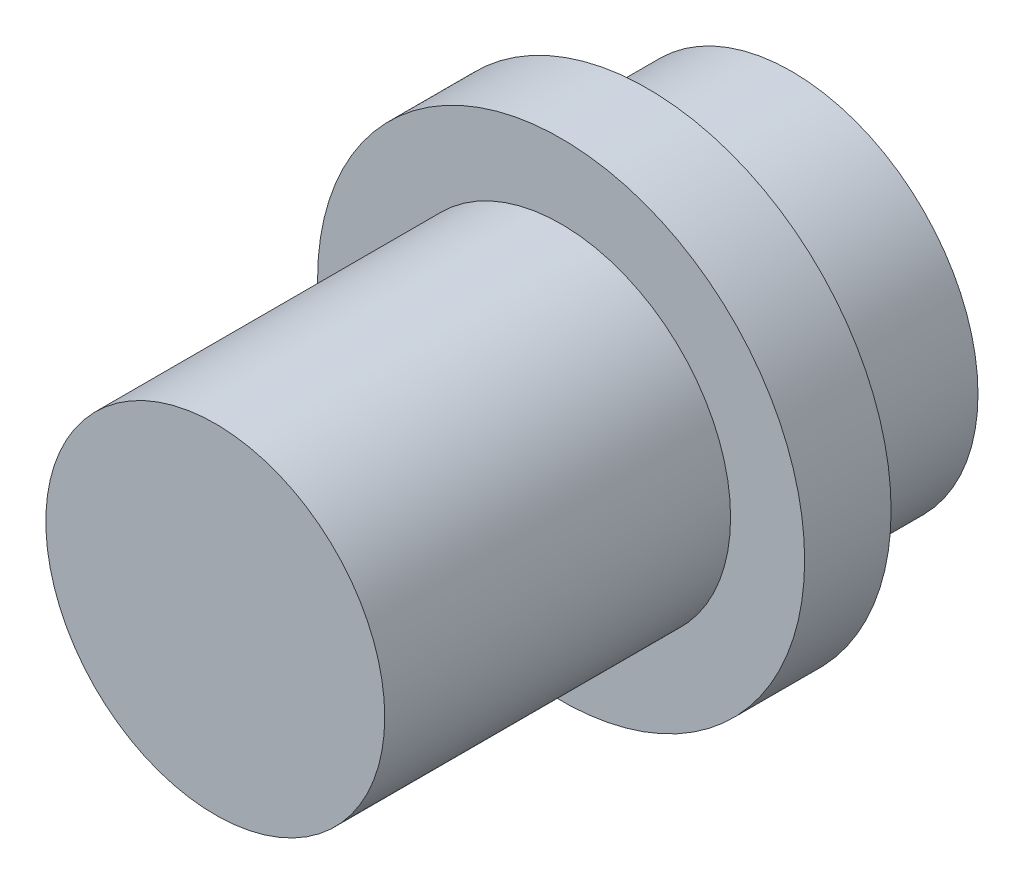
from build123d import *

# Parameters (mm, degrees)
SKETCH1_R           = 5.88
BOSS_EXTRUDE1_DEPTH = 12
SKETCH2_R           = 8.45
BOSS_EXTRUDE2_DEPTH = 3
SKETCH3_R           = 6.465
BOSS_EXTRUDE3_DEPTH = 5


with BuildPart() as part:
    # Sketch1 → Boss-Extrude1 (new body)
    with BuildSketch(Plane.XY):
        Circle(SKETCH1_R)
    extrude(amount=BOSS_EXTRUDE1_DEPTH)

    # Sketch2 → Boss-Extrude2 (add)
    with BuildSketch(Plane(origin=(0, 0, 0), x_dir=(-1, 0, 0), z_dir=(0, 0, -1))):
        Circle(SKETCH2_R)
    extrude(amount=BOSS_EXTRUDE2_DEPTH)

    # Sketch3 → Boss-Extrude3 (add)
    with BuildSketch(Plane(origin=(0, 0, -3), x_dir=(-1, 0, 0), z_dir=(0, 0, -1))):
        Circle(SKETCH3_R)
    extrude(amount=BOSS_EXTRUDE3_DEPTH)


solid = part.part
